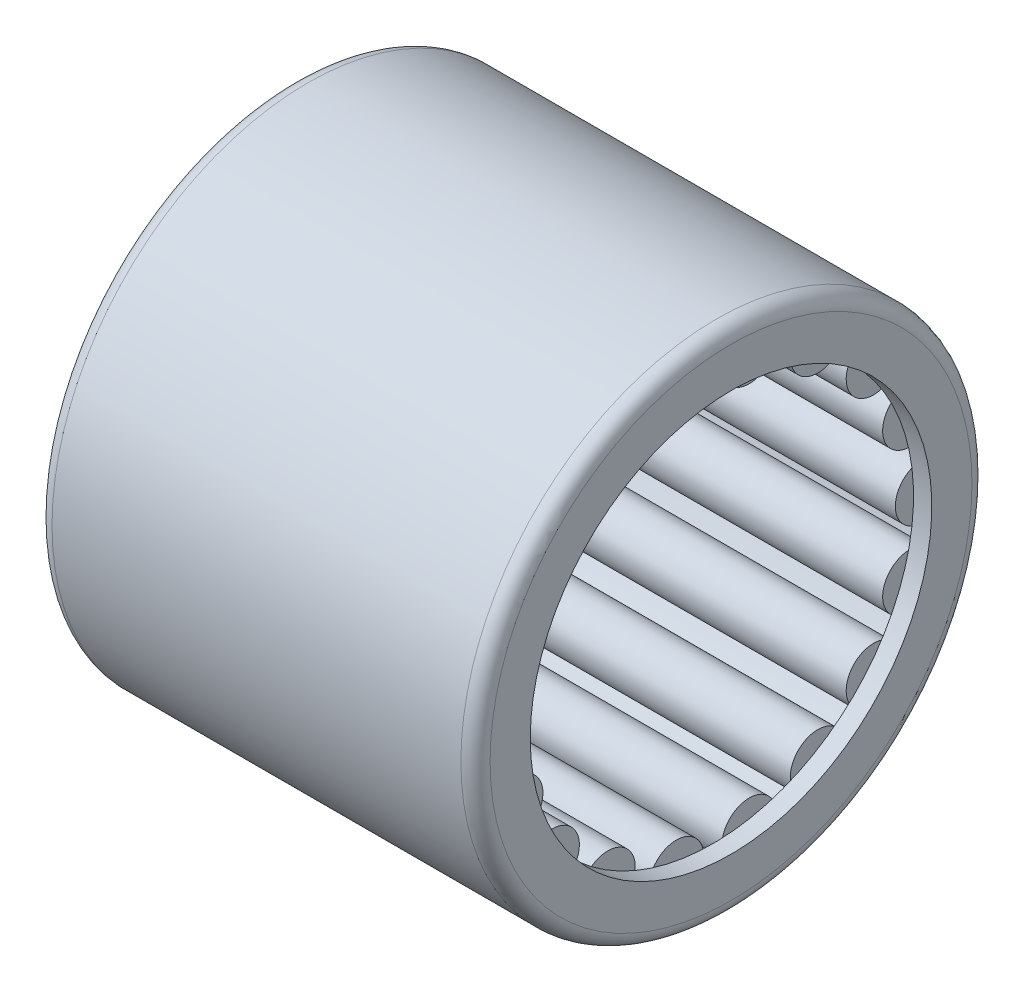
from build123d import *

# Parameters (mm, degrees)
SKETCH_5_R               = 0.75
EXTRUDE_3_DEPTH          = 11
PATTERN_CIRCULAR_8_COUNT = 18
FILLET_1_R               = 0.4


with BuildPart() as part:
    # 草图3 → 旋转1 (revolve)
    with BuildSketch(Plane.XY, mode=Mode.PRIVATE) as revolve_1_sk:
        Polygon((-6, 7), (-6, 5.5), (-5.5, 5.5), (-5.5, 6.5), (5.5, 6.5), (5.5, 5.5), (6, 5.5), (6, 7), align=None)
    revolve(revolve_1_sk.sketch.rotate(Axis((-6.202687828, 0, 0), (1, 0, 0)), 90), axis=Axis((-6.202687828, 0, 0), (1, 0, 0)))

    # 圆角1
    fillet_1_edges = [part.edges().sort_by_distance(p)[0] for p in [
        (-6, 0, -7),
        (6, 0, -7),
        (5.5, 0, -6.5),
        (-5.5, 0, -6.5),
    ]]
    fillet(fillet_1_edges, radius=FILLET_1_R)


with BuildPart() as body_2:
    # 草图5 → 凸台-拉伸3 (new body)
    with BuildSketch(Plane.ZY.offset(-5.5)):
        with Locations((-5.75, 0)):
            Circle(SKETCH_5_R)
    extrude(amount=EXTRUDE_3_DEPTH)


with BuildPart() as pattern_circular_8_1:
    # 阵列(圆周)8: pattern copy
    add(body_2.part.rotate(Axis((0, 0, 0), (1, 0, 0)), 1 * 360 / PATTERN_CIRCULAR_8_COUNT))


with BuildPart() as pattern_circular_8_2:
    # 阵列(圆周)8: pattern copy
    add(body_2.part.rotate(Axis((0, 0, 0), (1, 0, 0)), 2 * 360 / PATTERN_CIRCULAR_8_COUNT))


with BuildPart() as pattern_circular_8_3:
    # 阵列(圆周)8: pattern copy
    add(body_2.part.rotate(Axis((0, 0, 0), (1, 0, 0)), 3 * 360 / PATTERN_CIRCULAR_8_COUNT))


with BuildPart() as pattern_circular_8_4:
    # 阵列(圆周)8: pattern copy
    add(body_2.part.rotate(Axis((0, 0, 0), (1, 0, 0)), 4 * 360 / PATTERN_CIRCULAR_8_COUNT))


with BuildPart() as pattern_circular_8_5:
    # 阵列(圆周)8: pattern copy
    add(body_2.part.rotate(Axis((0, 0, 0), (1, 0, 0)), 5 * 360 / PATTERN_CIRCULAR_8_COUNT))


with BuildPart() as pattern_circular_8_6:
    # 阵列(圆周)8: pattern copy
    add(body_2.part.rotate(Axis((0, 0, 0), (1, 0, 0)), 6 * 360 / PATTERN_CIRCULAR_8_COUNT))


with BuildPart() as pattern_circular_8_7:
    # 阵列(圆周)8: pattern copy
    add(body_2.part.rotate(Axis((0, 0, 0), (1, 0, 0)), 7 * 360 / PATTERN_CIRCULAR_8_COUNT))


with BuildPart() as pattern_circular_8_8:
    # 阵列(圆周)8: pattern copy
    add(body_2.part.rotate(Axis((0, 0, 0), (1, 0, 0)), 8 * 360 / PATTERN_CIRCULAR_8_COUNT))


with BuildPart() as pattern_circular_8_9:
    # 阵列(圆周)8: pattern copy
    add(body_2.part.rotate(Axis((0, 0, 0), (1, 0, 0)), 9 * 360 / PATTERN_CIRCULAR_8_COUNT))


with BuildPart() as pattern_circular_8_10:
    # 阵列(圆周)8: pattern copy
    add(body_2.part.rotate(Axis((0, 0, 0), (1, 0, 0)), 10 * 360 / PATTERN_CIRCULAR_8_COUNT))


with BuildPart() as pattern_circular_8_11:
    # 阵列(圆周)8: pattern copy
    add(body_2.part.rotate(Axis((0, 0, 0), (1, 0, 0)), 11 * 360 / PATTERN_CIRCULAR_8_COUNT))


with BuildPart() as pattern_circular_8_12:
    # 阵列(圆周)8: pattern copy
    add(body_2.part.rotate(Axis((0, 0, 0), (1, 0, 0)), 12 * 360 / PATTERN_CIRCULAR_8_COUNT))


with BuildPart() as pattern_circular_8_13:
    # 阵列(圆周)8: pattern copy
    add(body_2.part.rotate(Axis((0, 0, 0), (1, 0, 0)), 13 * 360 / PATTERN_CIRCULAR_8_COUNT))


with BuildPart() as pattern_circular_8_14:
    # 阵列(圆周)8: pattern copy
    add(body_2.part.rotate(Axis((0, 0, 0), (1, 0, 0)), 14 * 360 / PATTERN_CIRCULAR_8_COUNT))


with BuildPart() as pattern_circular_8_15:
    # 阵列(圆周)8: pattern copy
    add(body_2.part.rotate(Axis((0, 0, 0), (1, 0, 0)), 15 * 360 / PATTERN_CIRCULAR_8_COUNT))


with BuildPart() as pattern_circular_8_16:
    # 阵列(圆周)8: pattern copy
    add(body_2.part.rotate(Axis((0, 0, 0), (1, 0, 0)), 16 * 360 / PATTERN_CIRCULAR_8_COUNT))


with BuildPart() as pattern_circular_8_17:
    # 阵列(圆周)8: pattern copy
    add(body_2.part.rotate(Axis((0, 0, 0), (1, 0, 0)), 17 * 360 / PATTERN_CIRCULAR_8_COUNT))


solid = Compound([part.part, body_2.part, pattern_circular_8_1.part, pattern_circular_8_2.part, pattern_circular_8_3.part, pattern_circular_8_4.part, pattern_circular_8_5.part, pattern_circular_8_6.part, pattern_circular_8_7.part, pattern_circular_8_8.part, pattern_circular_8_9.part, pattern_circular_8_10.part, pattern_circular_8_11.part, pattern_circular_8_12.part, pattern_circular_8_13.part, pattern_circular_8_14.part, pattern_circular_8_15.part, pattern_circular_8_16.part, pattern_circular_8_17.part])
